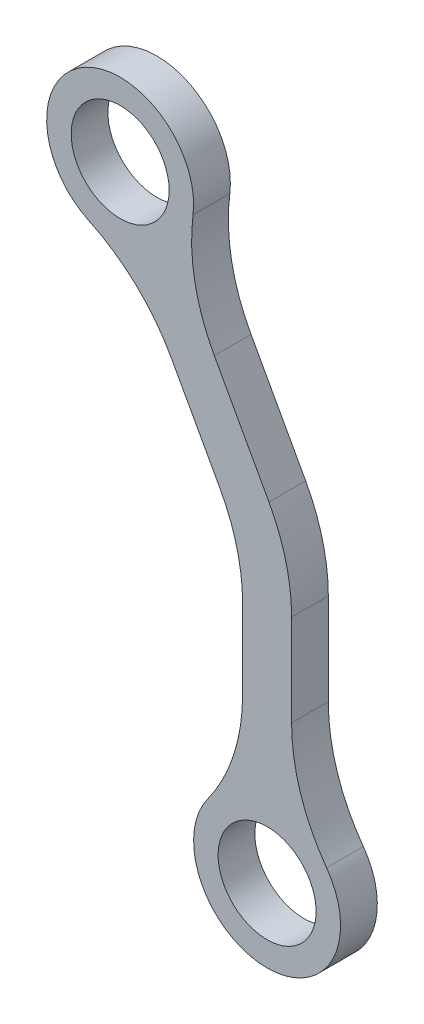
from build123d import *

# Parameters (mm, degrees)
SKETCH1_R           = 4
BOSS_EXTRUDE1_DEPTH = 1.5
FILLET3_R           = 15


with BuildPart() as part:
    # Sketch1 → Boss-Extrude1 (new, symmetric)
    with BuildSketch(Plane.XY):
        with BuildLine():
            Line((-2, 5.656854249), (-2, 22.630988629))
            Line((-2, 22.630988629), (-11.030624508, 39.078825188))
            ThreePointArc((-11.030624508, 39.078825188), (-14.887660916, 50.259411986), (-7.524349851, 41.003932465))
            Line((-7.524349851, 41.003932465), (2, 23.656854249))
            Line((2, 23.656854249), (2, 5.656854249))
            ThreePointArc((2, 5.656854249), (0, -6), (-2, 5.656854249))
        make_face()
        Circle(SKETCH1_R, mode=Mode.SUBTRACT)
        with Locations((-12, 45)):
            Circle(SKETCH1_R, mode=Mode.SUBTRACT)
    extrude(amount=BOSS_EXTRUDE1_DEPTH, both=True)

    # Fillet3
    fillet3_edges = [part.edges().sort_by_distance(p)[0] for p in [
        (-2, 5.656854249, 0),
        (-2, 22.630988629, 0),
        (-11.030624508, 39.078825188, 0),
        (-7.524349851, 41.003932465, 0),
        (2, 23.656854249, 0),
        (2, 5.656854249, 0),
    ]]
    fillet(fillet3_edges, radius=FILLET3_R)


solid = part.part
